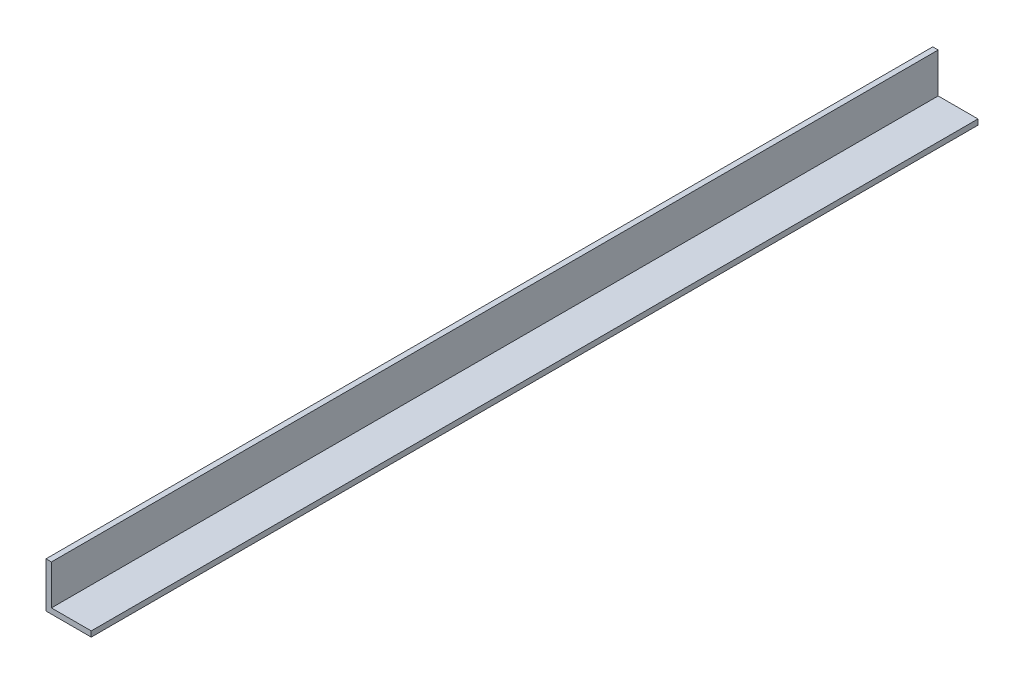
from build123d import *

# Parameters (mm, degrees)
SKETCH_1_W          = 100
SKETCH_1_H          = 100
EXTRUDE_1_DEPTH     = 1960
SKETCH_2_W          = 88
SKETCH_2_H          = 88
CUT_EXTRUDE_1_DEPTH = 1966.095417531


with BuildPart() as part:
    # 草图1 → 凸台-拉伸1 (new body)
    with BuildSketch(Plane.XY):
        with Locations((50, 50)):
            Rectangle(SKETCH_1_W, SKETCH_1_H)
    extrude(amount=EXTRUDE_1_DEPTH)

    # 草图2 → 切除-拉伸1 (cut, through all)
    with BuildSketch(Plane.XY.offset(1960)):
        with Locations((56, 56)):
            Rectangle(SKETCH_2_W, SKETCH_2_H)
    extrude(amount=-CUT_EXTRUDE_1_DEPTH, mode=Mode.SUBTRACT)


solid = part.part
